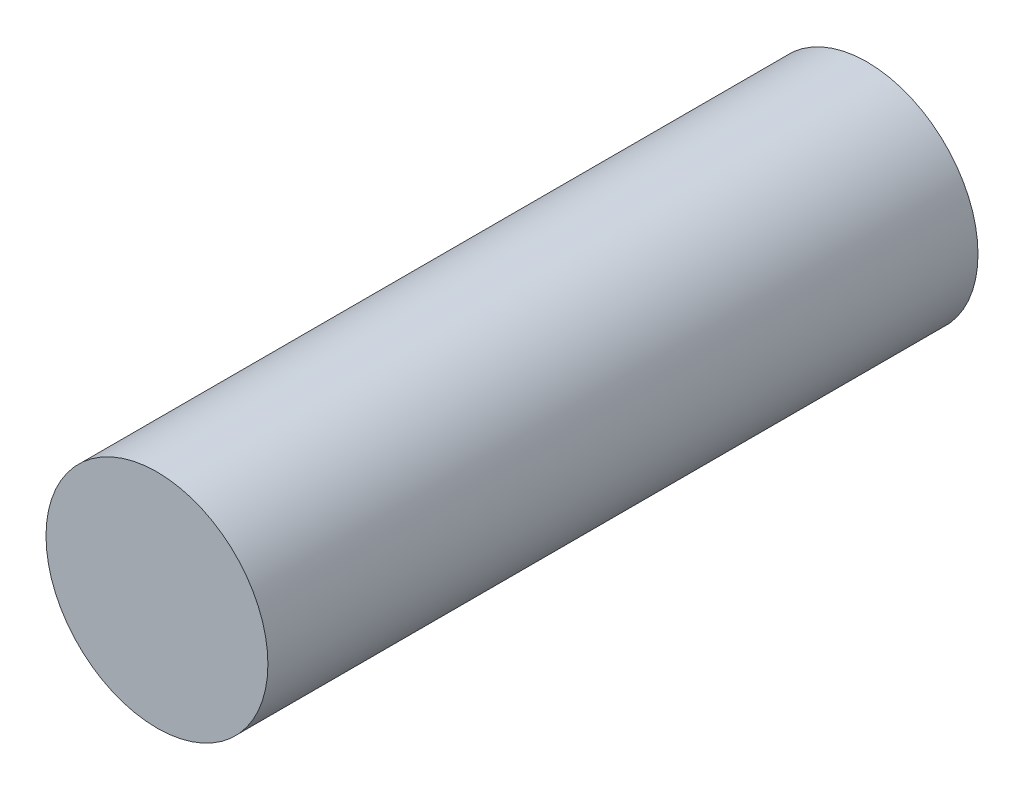
from build123d import *

# Parameters (mm, degrees)
SKETCH1_R           = 1.5875
BOSS_EXTRUDE1_DEPTH = 10.16


with BuildPart() as part:
    # Sketch1 → Boss-Extrude1 (new body)
    with BuildSketch(Plane.XY):
        with Locations((6780.775840345, 3567.968139787)):
            Circle(SKETCH1_R)
    extrude(amount=BOSS_EXTRUDE1_DEPTH)


solid = part.part
